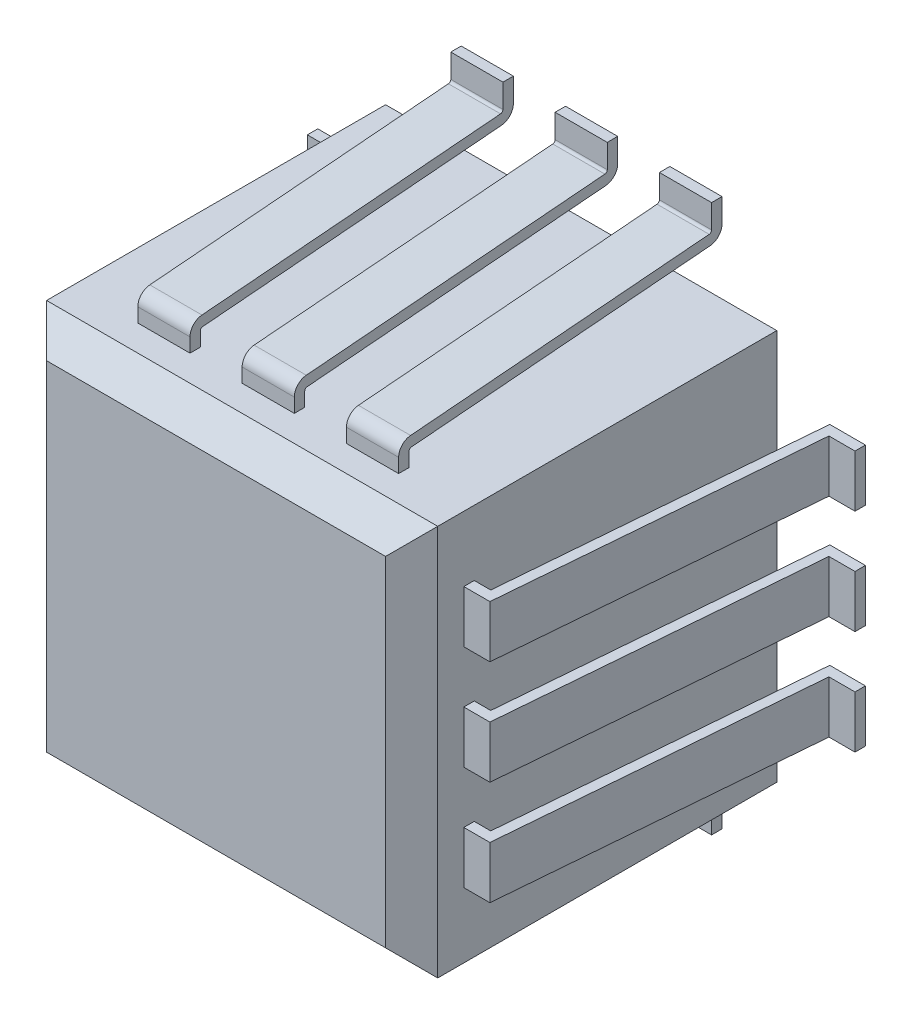
from build123d import *

# Parameters (mm, degrees)
COMPONENT_OUTLINE_W  = 1.5
COMPONENT_OUTLINE_H  = 1.5
EXTRUDE1_DEPTH       = 1.4
EXTRUDE_THIN1_DEPTH  = 0.1
LPATTERN1_COUNT      = 2
LPATTERN1_PITCH      = 0.4
LPATTERN1_COL_COUNT  = 2
LPATTERN1_COL_PITCH  = 0.4
MIRROR1_COPY_1_DEPTH = 0.1
MIRROR1_COPY_2_DEPTH = 0.1
EXTRUDE_THIN2_DEPTH  = 0.1
LPATTERN2_COUNT      = 2
LPATTERN2_PITCH      = 0.4
LPATTERN2_COL_COUNT  = 2
LPATTERN2_COL_PITCH  = 0.4
MIRROR2_COPY_1_DEPTH = 0.1
MIRROR2_COPY_2_DEPTH = 0.1
CHAMFER1_SIZE        = 0.1


with BuildPart() as part:
    # COMPONENT_OUTLINE → Extrude1 (new body)
    with BuildSketch(Plane.XY):
        Rectangle(COMPONENT_OUTLINE_W, COMPONENT_OUTLINE_H)
    extrude(amount=EXTRUDE1_DEPTH)

    # Sketch1 → Extrude-Thin1 (add, symmetric)
    with BuildSketch(Plane(origin=(0, 0, 0), x_dir=(0, 0, -1), z_dir=(1, 0, 0))):
        with BuildLine():
            Line((-1.2, 0.75), (-1.2, 0.803993356))
            ThreePointArc((-1.2, 0.803993356), (-1.186794114, 0.83784883), (-1.154152274, 0.853820644))
            Line((-1.154152274, 0.853820644), (-0.009169545, 0.949235871))
            ThreePointArc((-0.009169545, 0.949235871), (-0.002641177, 0.952430234), (0, 0.959201329))
            Line((0, 0.959201329), (0, 1.05))
            Line((0, 1.05), (0.04, 1.05))
            Line((0.04, 1.05), (0.04, 0.959201329))
            ThreePointArc((0.04, 0.959201329), (0.026794114, 0.925345854), (-0.005847726, 0.909374041))
            Line((-0.005847726, 0.909374041), (-1.150830455, 0.813958814))
            ThreePointArc((-1.150830455, 0.813958814), (-1.157358823, 0.810764451), (-1.16, 0.803993356))
            Line((-1.16, 0.803993356), (-1.16, 0.75))
            Line((-1.16, 0.75), (-1.2, 0.75))
        make_face()
    extrude_thin1 = extrude(amount=EXTRUDE_THIN1_DEPTH, both=True)

    # LPattern1: Extrude-Thin1 ×2
    with Locations(*[(-i * LPATTERN1_PITCH, 0, 0) for i in range(1, LPATTERN1_COUNT)]):
        add(extrude_thin1)

    # LPattern1 col: Extrude-Thin1 ×2
    with Locations(*[(i * LPATTERN1_COL_PITCH, 0, 0) for i in range(1, LPATTERN1_COL_COUNT)]):
        add(extrude_thin1)

    # Mirror1: Extrude-Thin1 across plane
    add(extrude_thin1.mirror(Plane.ZX))

    # Mirror1 copy 1 sketch → Mirror1 copy 1 (add, symmetric)
    with BuildSketch(Plane(origin=(-0.4, 0, 0), x_dir=(0, 0, -1), z_dir=(1, 0, 0))):
        with BuildLine():
            Line((-1.2, -0.75), (-1.2, -0.803993356))
            ThreePointArc((-1.2, -0.803993356), (-1.186794114, -0.83784883), (-1.154152274, -0.853820644))
            Line((-1.154152274, -0.853820644), (-0.009169545, -0.949235871))
            ThreePointArc((-0.009169545, -0.949235871), (-0.002641177, -0.952430234), (0, -0.959201329))
            Line((0, -0.959201329), (0, -1.05))
            Line((0, -1.05), (0.04, -1.05))
            Line((0.04, -1.05), (0.04, -0.959201329))
            ThreePointArc((0.04, -0.959201329), (0.026794114, -0.925345854), (-0.005847726, -0.909374041))
            Line((-0.005847726, -0.909374041), (-1.150830455, -0.813958814))
            ThreePointArc((-1.150830455, -0.813958814), (-1.157358823, -0.810764451), (-1.16, -0.803993356))
            Line((-1.16, -0.803993356), (-1.16, -0.75))
            Line((-1.16, -0.75), (-1.2, -0.75))
        make_face()
    extrude(amount=MIRROR1_COPY_1_DEPTH, both=True)

    # Mirror1 copy 2 sketch → Mirror1 copy 2 (add, symmetric)
    with BuildSketch(Plane(origin=(0.4, 0, 0), x_dir=(0, 0, -1), z_dir=(1, 0, 0))):
        with BuildLine():
            Line((-1.2, -0.75), (-1.2, -0.803993356))
            ThreePointArc((-1.2, -0.803993356), (-1.186794114, -0.83784883), (-1.154152274, -0.853820644))
            Line((-1.154152274, -0.853820644), (-0.009169545, -0.949235871))
            ThreePointArc((-0.009169545, -0.949235871), (-0.002641177, -0.952430234), (0, -0.959201329))
            Line((0, -0.959201329), (0, -1.05))
            Line((0, -1.05), (0.04, -1.05))
            Line((0.04, -1.05), (0.04, -0.959201329))
            ThreePointArc((0.04, -0.959201329), (0.026794114, -0.925345854), (-0.005847726, -0.909374041))
            Line((-0.005847726, -0.909374041), (-1.150830455, -0.813958814))
            ThreePointArc((-1.150830455, -0.813958814), (-1.157358823, -0.810764451), (-1.16, -0.803993356))
            Line((-1.16, -0.803993356), (-1.16, -0.75))
            Line((-1.16, -0.75), (-1.2, -0.75))
        make_face()
    extrude(amount=MIRROR1_COPY_2_DEPTH, both=True)

    # Sketch2 → Extrude-Thin2 (add, symmetric)
    with BuildSketch(Plane(origin=(0, 0, 0), x_dir=(1, 0, 0), z_dir=(0, 1, 0))):
        Polygon((0.75, -1.2), (0.85, -1.2), (0.95, 0), (1.05, 0), (1.05, 0.04), (0.913194685, 0.04), (0.813194685, -1.16), (0.75, -1.16), align=None)
    extrude_thin2 = extrude(amount=EXTRUDE_THIN2_DEPTH, both=True)

    # LPattern2: Extrude-Thin2 ×2
    with Locations(*[(0, i * LPATTERN2_PITCH, 0) for i in range(1, LPATTERN2_COUNT)]):
        add(extrude_thin2)

    # LPattern2 col: Extrude-Thin2 ×2
    with Locations(*[(0, -i * LPATTERN2_COL_PITCH, 0) for i in range(1, LPATTERN2_COL_COUNT)]):
        add(extrude_thin2)

    # Mirror2: Extrude-Thin2 across plane
    add(extrude_thin2.mirror(Plane(origin=(0, 0, 0), x_dir=(0, 0, 1), z_dir=(1, 0, 0))))

    # Mirror2 copy 1 sketch → Mirror2 copy 1 (add, symmetric)
    with BuildSketch(Plane(origin=(0, 0.4, 0), x_dir=(-1, 0, 0), z_dir=(0, 1, 0))):
        Polygon((0.75, 1.2), (0.85, 1.2), (0.95, 0), (1.05, 0), (1.05, -0.04), (0.913194685, -0.04), (0.813194685, 1.16), (0.75, 1.16), align=None)
    extrude(amount=MIRROR2_COPY_1_DEPTH, both=True)

    # Mirror2 copy 2 sketch → Mirror2 copy 2 (add, symmetric)
    with BuildSketch(Plane(origin=(0, -0.4, 0), x_dir=(-1, 0, 0), z_dir=(0, 1, 0))):
        Polygon((0.75, 1.2), (0.85, 1.2), (0.95, 0), (1.05, 0), (1.05, -0.04), (0.913194685, -0.04), (0.813194685, 1.16), (0.75, 1.16), align=None)
    extrude(amount=MIRROR2_COPY_2_DEPTH, both=True)

    # Chamfer1
    chamfer1_edges = [part.edges().sort_by_distance(p)[0] for p in [
        (0, -0.75, 1.4),
        (0.75, 0, 1.4),
        (0, 0.75, 1.4),
        (-0.75, 0, 1.4),
    ]]
    chamfer(chamfer1_edges, length=CHAMFER1_SIZE)


solid = part.part
